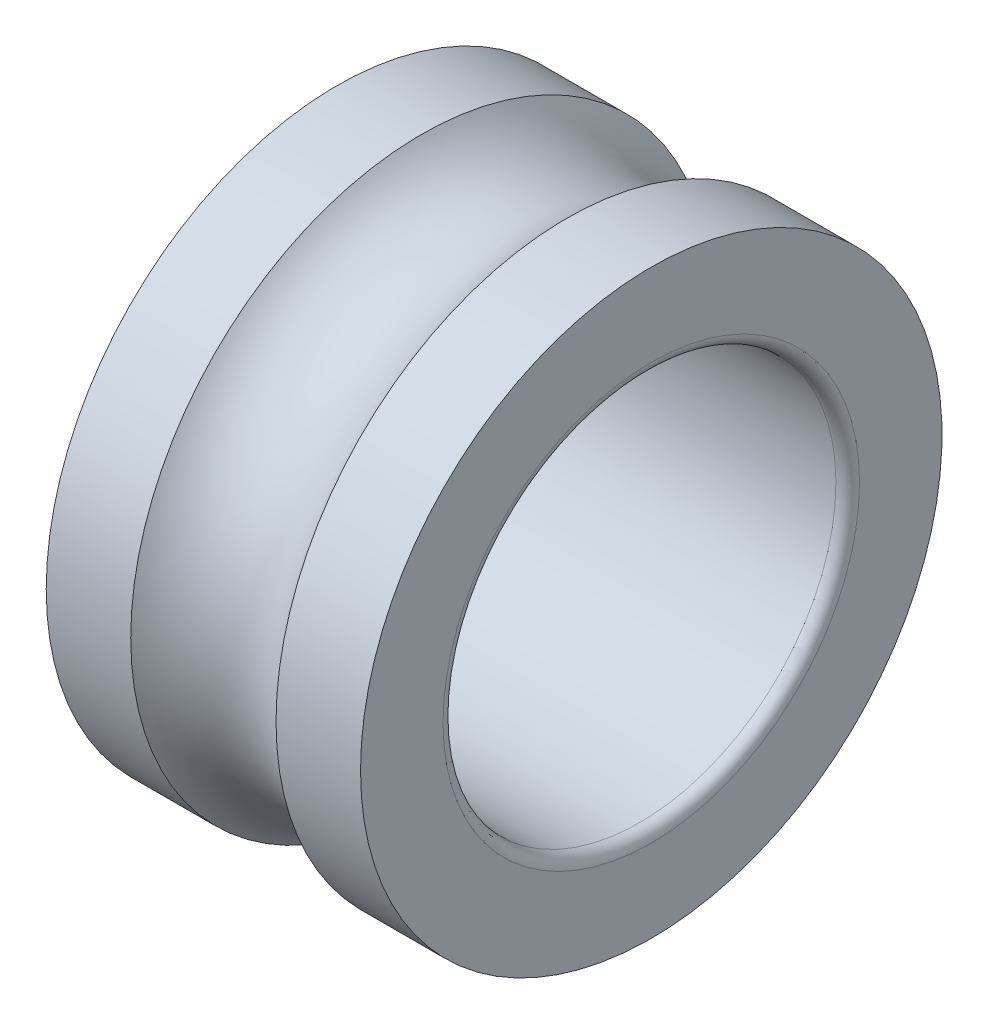
from build123d import *


with BuildPart() as part:
    # Sketch1 → Revolve1 (revolve)
    with BuildSketch(Plane.XY, mode=Mode.PRIVATE) as revolve1_sk:
        with BuildLine():
            Line((0.3, 5), (7.7, 5))
            ThreePointArc((7.7, 5), (7.912132034, 5.087867966), (8, 5.3))
            Line((8, 5.3), (8, 7.4))
            Line((8, 7.4), (5.849097347, 7.4))
            ThreePointArc((5.849097347, 7.4), (4, 6.519), (2.150902653, 7.4))
            Line((2.150902653, 7.4), (0, 7.4))
            Line((0, 7.4), (0, 5.3))
            ThreePointArc((0, 5.3), (0.087867966, 5.087867966), (0.3, 5))
        make_face()
    revolve(revolve1_sk.sketch.rotate(Axis((50, 0, 0), (-1, 0, 0)), 270), axis=Axis((50, 0, 0), (-1, 0, 0)))


solid = part.part
